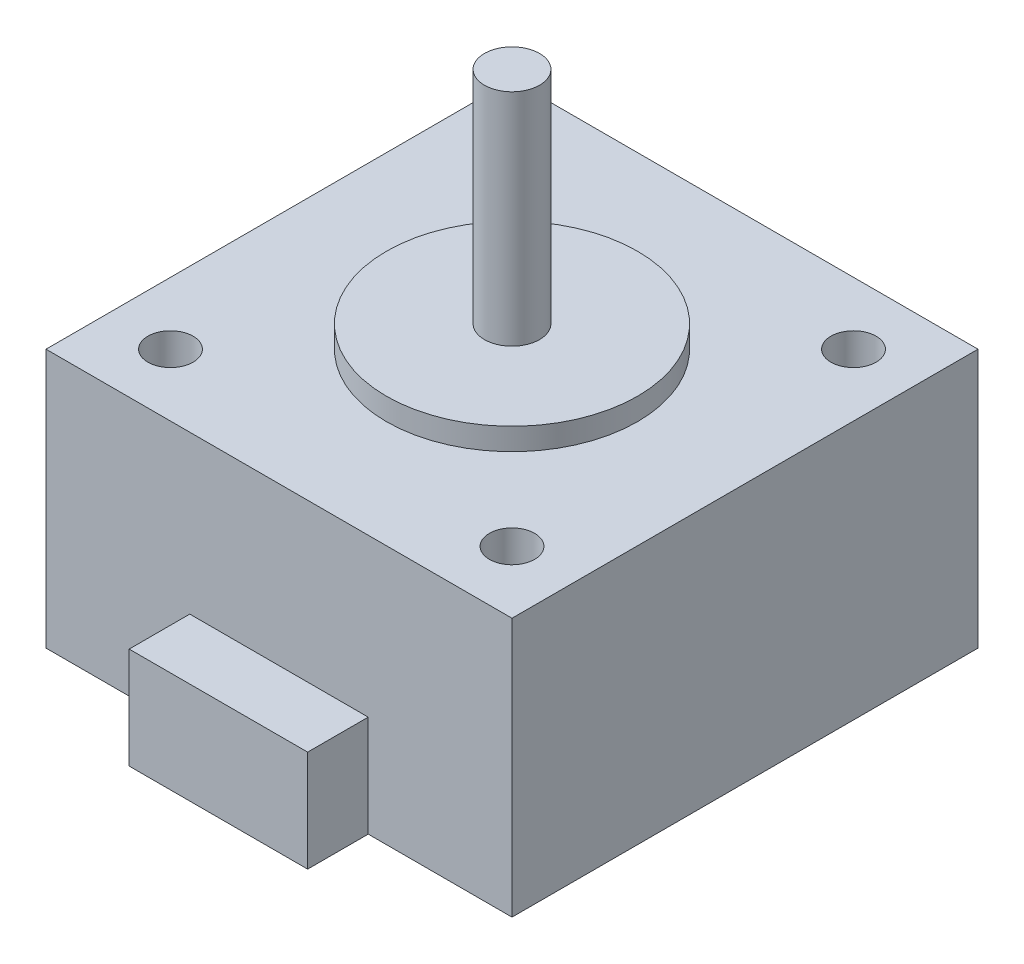
from build123d import *

# Parameters (mm, degrees)
SKETCH1_W           = 42.3
SKETCH1_H           = 42.3
BOSS_EXTRUDE1_DEPTH = 23.5
SKETCH2_R           = 2.05
CUT_EXTRUDE1_DEPTH  = 4.5
SKETCH3_R           = 11.4
BOSS_EXTRUDE2_DEPTH = 2
SKETCH3_3_R         = 2.5
BOSS_EXTRUDE3_DEPTH = 22
SKETCH4_W           = 16.2
SKETCH4_H           = 9.2
BOSS_EXTRUDE4_DEPTH = 5.5


with BuildPart() as part:
    # Sketch1 → Boss-Extrude1 (new body)
    with BuildSketch(Plane(origin=(0, 0, 0), x_dir=(1, 0, 0), z_dir=(0, 1, 0))):
        Rectangle(SKETCH1_W, SKETCH1_H)
    extrude(amount=-BOSS_EXTRUDE1_DEPTH)

    # Sketch2 → Cut-Extrude1 (cut)
    with BuildSketch(Plane(origin=(0, 0, 0), x_dir=(1, 0, 0), z_dir=(0, 1, 0))):
        with Locations((-15.5, -15.5)):
            Circle(SKETCH2_R)
        with Locations((15.5, -15.5)):
            Circle(SKETCH2_R)
        with Locations((-15.5, 15.5)):
            Circle(SKETCH2_R)
        with Locations((15.5, 15.5)):
            Circle(SKETCH2_R)
    extrude(amount=-CUT_EXTRUDE1_DEPTH, mode=Mode.SUBTRACT)

    # Sketch3 → Boss-Extrude2 (add)
    with BuildSketch(Plane(origin=(0, 0, 0), x_dir=(1, 0, 0), z_dir=(0, 1, 0))):
        Circle(SKETCH3_R)
    extrude(amount=BOSS_EXTRUDE2_DEPTH)

    # Sketch3<3> → Boss-Extrude3 (add)
    with BuildSketch(Plane(origin=(0, 0, 0), x_dir=(1, 0, 0), z_dir=(0, 1, 0))):
        Circle(SKETCH3_3_R)
    extrude(amount=BOSS_EXTRUDE3_DEPTH)

    # Sketch4 → Boss-Extrude4 (add)
    with BuildSketch(Plane.XY.offset(21.15)):
        with Locations((0, -18.9)):
            Rectangle(SKETCH4_W, SKETCH4_H)
    extrude(amount=BOSS_EXTRUDE4_DEPTH)


solid = part.part
